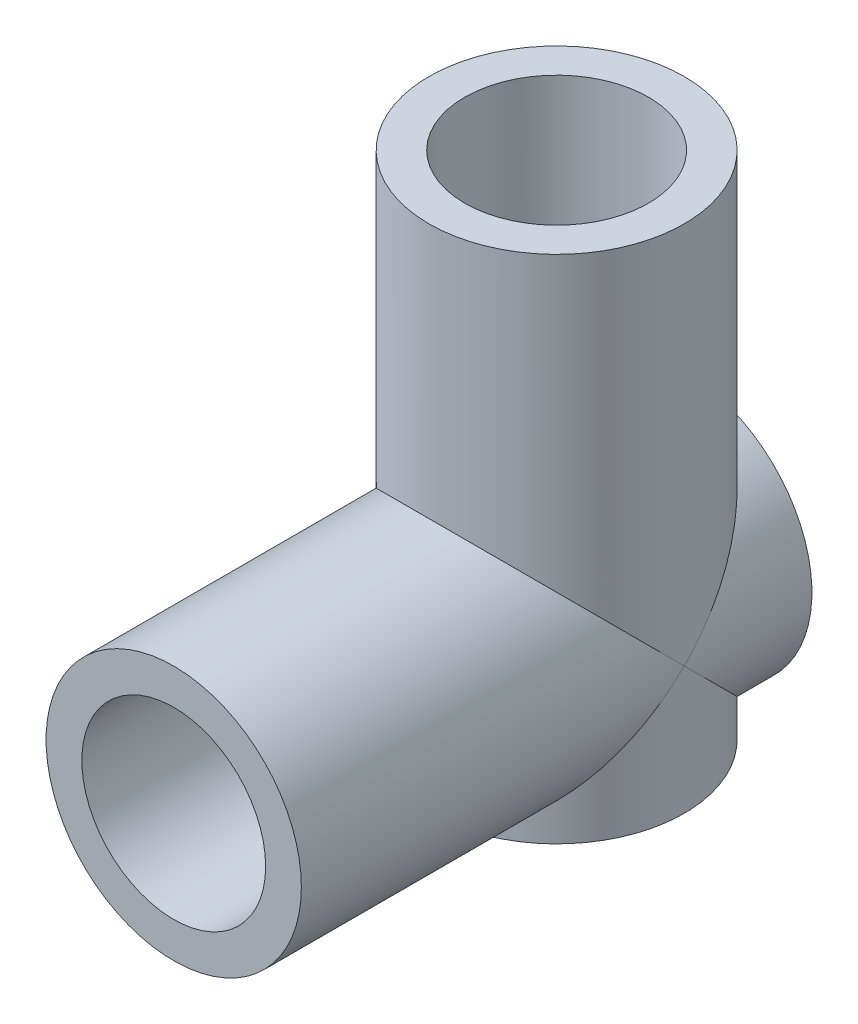
from build123d import *

# Parameters (mm, degrees)
SKETCH1_R            = 3.75
SKETCH1_R_2          = 2.7
BOSS_EXTRUDE1_DEPTH  = 15
BOSS_EXTRUDE7_START  = -3.75
SKETCH4_R            = 3.75
SKETCH4_R_2          = 2.7
BOSS_EXTRUDE7_DEPTH  = 15
SKETCH5_R            = 2.7
CUT_EXTRUDE1_DEPTH   = 15
SKETCH9_R            = 2.7
BOSS_EXTRUDE11_DEPTH = 1
SKETCH10_R           = 2.7
BOSS_EXTRUDE12_DEPTH = 1
CUT_EXTRUDE10_START  = -12
SKETCH11_R           = 2.7
CUT_EXTRUDE10_DEPTH  = 12
CUT_EXTRUDE11_START  = -12
SKETCH13_R           = 2.7
CUT_EXTRUDE11_DEPTH  = 12
CUT_EXTRUDE2_START   = 3.75
SKETCH6_R            = 2.7
CUT_EXTRUDE2_DEPTH   = 15
SKETCH8_R            = 2.7
BOSS_EXTRUDE9_DEPTH  = 1


with BuildPart() as part:
    # Sketch1 → Boss-Extrude1 (new body)
    with BuildSketch(Plane.XY):
        Circle(SKETCH1_R)
        Circle(SKETCH1_R_2, mode=Mode.SUBTRACT)
    extrude(amount=BOSS_EXTRUDE1_DEPTH)

    # Sketch4 → Boss-Extrude7 (add)
    with BuildSketch(Plane(origin=(0, 0, 0), x_dir=(1, 0, 0), z_dir=(0, 1, 0)).offset(BOSS_EXTRUDE7_START)):
        with Locations(Location((0, -3.75, 0), (0, 0, 90))):
            Circle(SKETCH4_R)
        with Locations(Location((0, -3.75, 0), (0, 0, 90))):
            Circle(SKETCH4_R_2, mode=Mode.SUBTRACT)
    extrude(amount=BOSS_EXTRUDE7_DEPTH)

    # Sketch5 → Cut-Extrude1 (cut)
    with BuildSketch(Plane(origin=(0, 0, 0), x_dir=(1, 0, 0), z_dir=(0, 1, 0))):
        with Locations((0, -3.75)):
            Circle(SKETCH5_R)
    extrude(amount=CUT_EXTRUDE1_DEPTH, mode=Mode.SUBTRACT)

    # Sketch9 → Boss-Extrude11 (add)
    with BuildSketch(Plane.XZ.offset(3.75)):
        with Locations((0, 3.75)):
            Circle(SKETCH9_R)
    extrude(amount=-BOSS_EXTRUDE11_DEPTH)

    # Sketch10 → Boss-Extrude12 (add)
    with BuildSketch(Plane(origin=(0, 0, 0), x_dir=(-1, 0, 0), z_dir=(0, 0, -1))):
        Circle(SKETCH10_R)
    extrude(amount=-BOSS_EXTRUDE12_DEPTH)

    # Sketch11 → Cut-Extrude10 (cut)
    with BuildSketch(Plane(origin=(0, 11.25, 0), x_dir=(1, 0, 0), z_dir=(0, 1, 0)).offset(CUT_EXTRUDE10_START)):
        with Locations(Location((0, -3.75, 0), (0, 0, 163.872379787))):
            Circle(SKETCH11_R)
    extrude(amount=CUT_EXTRUDE10_DEPTH, mode=Mode.SUBTRACT)

    # Sketch13 → Cut-Extrude11 (cut)
    with BuildSketch(Plane.XY.offset(15).offset(CUT_EXTRUDE11_START)):
        Circle(SKETCH13_R)
    extrude(amount=CUT_EXTRUDE11_DEPTH, mode=Mode.SUBTRACT)

    # Sketch6 → Cut-Extrude2 (cut)
    with BuildSketch(Plane.XY.offset(CUT_EXTRUDE2_START)):
        Circle(SKETCH6_R)
    extrude(amount=CUT_EXTRUDE2_DEPTH, mode=Mode.SUBTRACT)

    # Sketch8 → Boss-Extrude9 (add)
    with BuildSketch(Plane(origin=(0, 0, 0), x_dir=(-1, 0, 0), z_dir=(0, 0, -1))):
        with Locations(Location((0, 0, 0), (0, 0, 180))):
            Circle(SKETCH8_R)
    extrude(amount=-BOSS_EXTRUDE9_DEPTH)


solid = part.part
